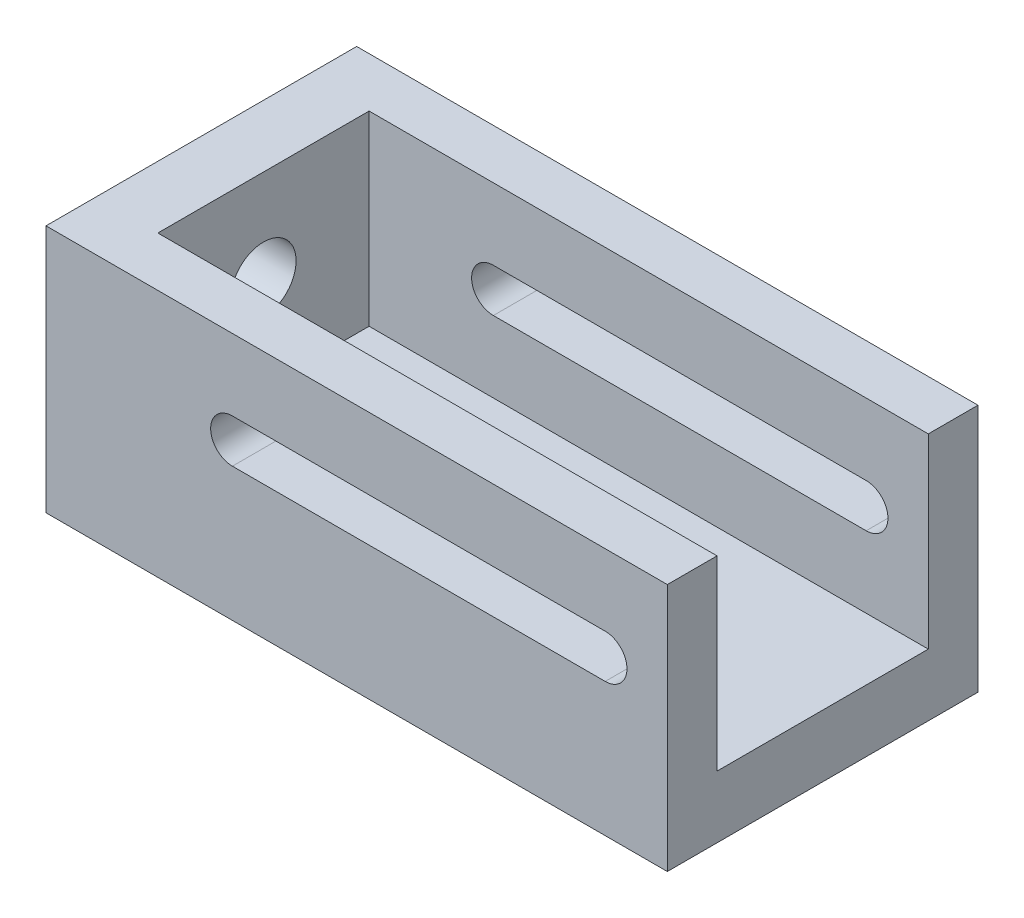
from build123d import *

# Parameters (mm, degrees)
ESQUISSE1_W                                        = 100
ESQUISSE1_H                                        = 50
BOSS_EXTRU_1_DEPTH                                 = 10
ESQUISSE2_W                                        = 100
ESQUISSE2_H                                        = 8
BOSS_EXTRU_2_DEPTH                                 = 30
ESQUISSE3_W                                        = 10
ESQUISSE3_H                                        = 34
BOSS_EXTRU_3_DEPTH                                 = 30
ESQUISSE5_R                                        = 5.25
ENL_V_MAT_EXTRU_1_DEPTH                            = 111.566721937
ENL_V_MAT_EXTRU_4_DEPTH                            = 82.240384046
CHAMBRAGE_POUR_VIS_T_TE_RONDE_BOMB_E_M_D           = 5.5
CHAMBRAGE_POUR_VIS_T_TE_RONDE_BOMB_E_M_CBORE_D     = 10
CHAMBRAGE_POUR_VIS_T_TE_RONDE_BOMB_E_M_CBORE_DEPTH = 5


with BuildPart() as part:
    # Esquisse1 → Boss.-Extru.1 (new body)
    with BuildSketch(Plane(origin=(0, 0, 0), x_dir=(1, 0, 0), z_dir=(0, 1, 0))):
        Rectangle(ESQUISSE1_W, ESQUISSE1_H)
    extrude(amount=BOSS_EXTRU_1_DEPTH)

    # Esquisse2 → Boss.-Extru.2 (add)
    with BuildSketch(Plane(origin=(0, 10, 0), x_dir=(1, 0, 0), z_dir=(0, 1, 0))):
        with Locations((0, -21)):
            Rectangle(ESQUISSE2_W, ESQUISSE2_H)
        with Locations((0, 21)):
            Rectangle(ESQUISSE2_W, ESQUISSE2_H)
    extrude(amount=BOSS_EXTRU_2_DEPTH)

    # Esquisse3 → Boss.-Extru.3 (add)
    with BuildSketch(Plane(origin=(0, 10, 0), x_dir=(1, 0, 0), z_dir=(0, 1, 0))):
        with Locations((-45, 0)):
            Rectangle(ESQUISSE3_W, ESQUISSE3_H)
    extrude(amount=BOSS_EXTRU_3_DEPTH)

    # Esquisse5 → Enlèv. mat.-Extru.1 (cut, through all)
    with BuildSketch(Plane.ZY.offset(50)):
        with Locations((0, 25)):
            Circle(ESQUISSE5_R)
    extrude(amount=-ENL_V_MAT_EXTRU_1_DEPTH, mode=Mode.SUBTRACT)

    # Esquisse8 → Enlèv. mat.-Extru.4 (cut, through all)
    with BuildSketch(Plane.XY.offset(25)):
        with BuildLine():
            Line((-20, 28.5), (40, 28.5))
            ThreePointArc((40, 28.5), (43.5, 25), (40, 21.5))
            Line((40, 21.5), (-20, 21.5))
            ThreePointArc((-20, 21.5), (-23.5, 25), (-20, 28.5))
        make_face()
    extrude(amount=-ENL_V_MAT_EXTRU_4_DEPTH, mode=Mode.SUBTRACT)

    # Chambrage pour vis à tête ronde bombée M51 (through all)
    with Locations(Plane(origin=(0, 10, 0), x_dir=(1, 0, 0), z_dir=(0, 1, 0))):
        with Locations((-25, 0), (0, 0)):
            CounterBoreHole(CHAMBRAGE_POUR_VIS_T_TE_RONDE_BOMB_E_M_D / 2, CHAMBRAGE_POUR_VIS_T_TE_RONDE_BOMB_E_M_CBORE_D / 2, CHAMBRAGE_POUR_VIS_T_TE_RONDE_BOMB_E_M_CBORE_DEPTH)


solid = part.part
